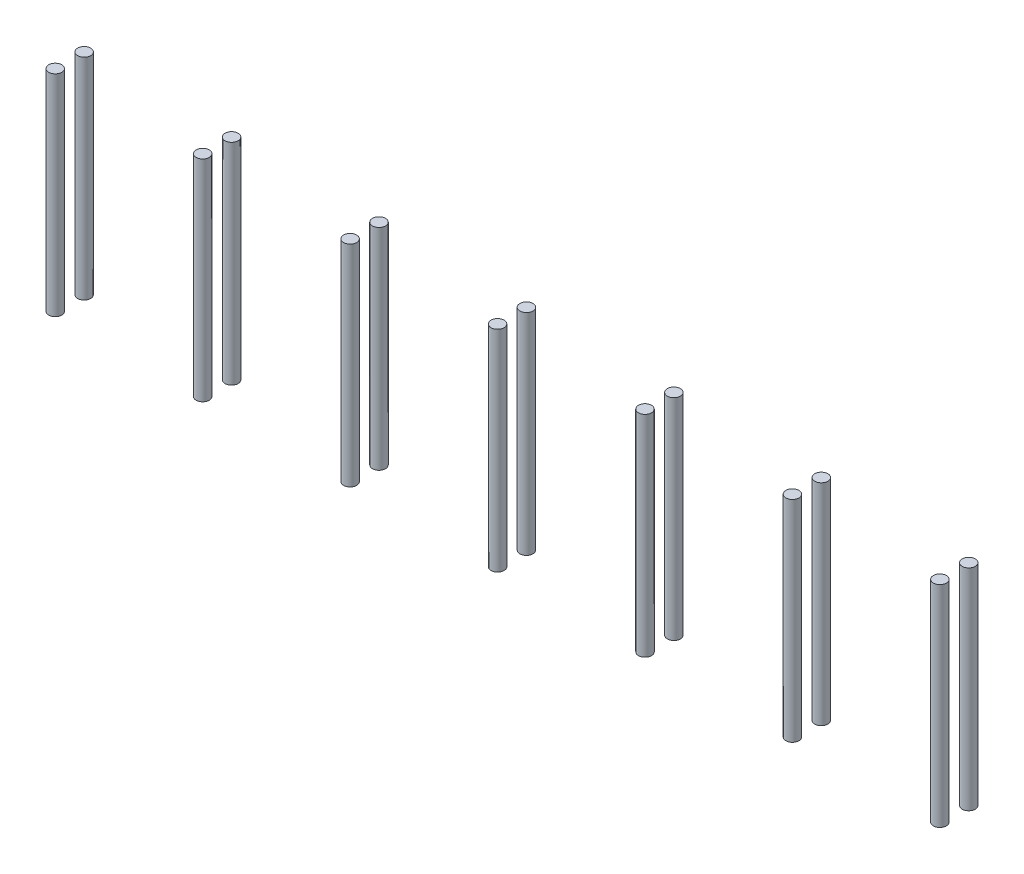
from build123d import *

# Parameters (mm, degrees)
SKETCH1_R              = 3.175
BOSS_EXTRUDE1_DEPTH    = 102
BOSS_EXTRUDE1_2_DEPTH  = 102
BOSS_EXTRUDE1_3_DEPTH  = 102
BOSS_EXTRUDE1_4_DEPTH  = 102
BOSS_EXTRUDE1_5_DEPTH  = 102
BOSS_EXTRUDE1_6_DEPTH  = 102
BOSS_EXTRUDE1_7_DEPTH  = 102
BOSS_EXTRUDE1_8_DEPTH  = 102
BOSS_EXTRUDE1_9_DEPTH  = 102
BOSS_EXTRUDE1_10_DEPTH = 102
BOSS_EXTRUDE1_11_DEPTH = 102
BOSS_EXTRUDE1_12_DEPTH = 102
BOSS_EXTRUDE1_13_DEPTH = 102
BOSS_EXTRUDE1_14_DEPTH = 102


with BuildPart() as part:
    # Sketch1 → Boss-Extrude1 (new body)
    with BuildSketch(Plane(origin=(0, -1, 0), x_dir=(1, 0, 0), z_dir=(0, 1, 0))):
        with Locations(Location((-66.5, 42, 0), (0, 0, 180))):
            Circle(SKETCH1_R)
    extrude(amount=BOSS_EXTRUDE1_DEPTH)


with BuildPart() as body_2:
    # Sketch1 → Boss-Extrude1 2 (new body)
    with BuildSketch(Plane(origin=(0, -1, 0), x_dir=(1, 0, 0), z_dir=(0, 1, 0))):
        with Locations(Location((-66.5, 28, 0), (0, 0, 180))):
            Circle(SKETCH1_R)
    extrude(amount=BOSS_EXTRUDE1_2_DEPTH)


with BuildPart() as body_3:
    # Sketch1 → Boss-Extrude1 3 (new body)
    with BuildSketch(Plane(origin=(0, -1, 0), x_dir=(1, 0, 0), z_dir=(0, 1, 0))):
        with Locations(Location((5, 42, 0), (0, 0, 180))):
            Circle(SKETCH1_R)
    extrude(amount=BOSS_EXTRUDE1_3_DEPTH)


with BuildPart() as body_4:
    # Sketch1 → Boss-Extrude1 4 (new body)
    with BuildSketch(Plane(origin=(0, -1, 0), x_dir=(1, 0, 0), z_dir=(0, 1, 0))):
        with Locations(Location((5, 28, 0), (0, 0, 180))):
            Circle(SKETCH1_R)
    extrude(amount=BOSS_EXTRUDE1_4_DEPTH)


with BuildPart() as body_5:
    # Sketch1 → Boss-Extrude1 5 (new body)
    with BuildSketch(Plane(origin=(0, -1, 0), x_dir=(1, 0, 0), z_dir=(0, 1, 0))):
        with Locations(Location((76.5, 42, 0), (0, 0, 180))):
            Circle(SKETCH1_R)
    extrude(amount=BOSS_EXTRUDE1_5_DEPTH)


with BuildPart() as body_6:
    # Sketch1 → Boss-Extrude1 6 (new body)
    with BuildSketch(Plane(origin=(0, -1, 0), x_dir=(1, 0, 0), z_dir=(0, 1, 0))):
        with Locations(Location((76.5, 28, 0), (0, 0, 180))):
            Circle(SKETCH1_R)
    extrude(amount=BOSS_EXTRUDE1_6_DEPTH)


with BuildPart() as body_7:
    # Sketch1 → Boss-Extrude1 7 (new body)
    with BuildSketch(Plane(origin=(0, -1, 0), x_dir=(1, 0, 0), z_dir=(0, 1, 0))):
        with Locations(Location((148, 42, 0), (0, 0, 180))):
            Circle(SKETCH1_R)
    extrude(amount=BOSS_EXTRUDE1_7_DEPTH)


with BuildPart() as body_8:
    # Sketch1 → Boss-Extrude1 8 (new body)
    with BuildSketch(Plane(origin=(0, -1, 0), x_dir=(1, 0, 0), z_dir=(0, 1, 0))):
        with Locations(Location((148, 28, 0), (0, 0, 180))):
            Circle(SKETCH1_R)
    extrude(amount=BOSS_EXTRUDE1_8_DEPTH)


with BuildPart() as body_9:
    # Sketch1 → Boss-Extrude1 9 (new body)
    with BuildSketch(Plane(origin=(0, -1, 0), x_dir=(1, 0, 0), z_dir=(0, 1, 0))):
        with Locations(Location((219.5, 42, 0), (0, 0, 180))):
            Circle(SKETCH1_R)
    extrude(amount=BOSS_EXTRUDE1_9_DEPTH)


with BuildPart() as body_10:
    # Sketch1 → Boss-Extrude1 10 (new body)
    with BuildSketch(Plane(origin=(0, -1, 0), x_dir=(1, 0, 0), z_dir=(0, 1, 0))):
        with Locations(Location((219.5, 28, 0), (0, 0, 180))):
            Circle(SKETCH1_R)
    extrude(amount=BOSS_EXTRUDE1_10_DEPTH)


with BuildPart() as body_11:
    # Sketch1 → Boss-Extrude1 11 (new body)
    with BuildSketch(Plane(origin=(0, -1, 0), x_dir=(1, 0, 0), z_dir=(0, 1, 0))):
        with Locations(Location((291, 42, 0), (0, 0, 180))):
            Circle(SKETCH1_R)
    extrude(amount=BOSS_EXTRUDE1_11_DEPTH)


with BuildPart() as body_12:
    # Sketch1 → Boss-Extrude1 12 (new body)
    with BuildSketch(Plane(origin=(0, -1, 0), x_dir=(1, 0, 0), z_dir=(0, 1, 0))):
        with Locations(Location((291, 28, 0), (0, 0, 180))):
            Circle(SKETCH1_R)
    extrude(amount=BOSS_EXTRUDE1_12_DEPTH)


with BuildPart() as body_13:
    # Sketch1 → Boss-Extrude1 13 (new body)
    with BuildSketch(Plane(origin=(0, -1, 0), x_dir=(1, 0, 0), z_dir=(0, 1, 0))):
        with Locations(Location((362.5, 42, 0), (0, 0, 180))):
            Circle(SKETCH1_R)
    extrude(amount=BOSS_EXTRUDE1_13_DEPTH)


with BuildPart() as body_14:
    # Sketch1 → Boss-Extrude1 14 (new body)
    with BuildSketch(Plane(origin=(0, -1, 0), x_dir=(1, 0, 0), z_dir=(0, 1, 0))):
        with Locations(Location((362.5, 28, 0), (0, 0, 180))):
            Circle(SKETCH1_R)
    extrude(amount=BOSS_EXTRUDE1_14_DEPTH)


solid = Compound([part.part, body_2.part, body_3.part, body_4.part, body_5.part, body_6.part, body_7.part, body_8.part, body_9.part, body_10.part, body_11.part, body_12.part, body_13.part, body_14.part])
